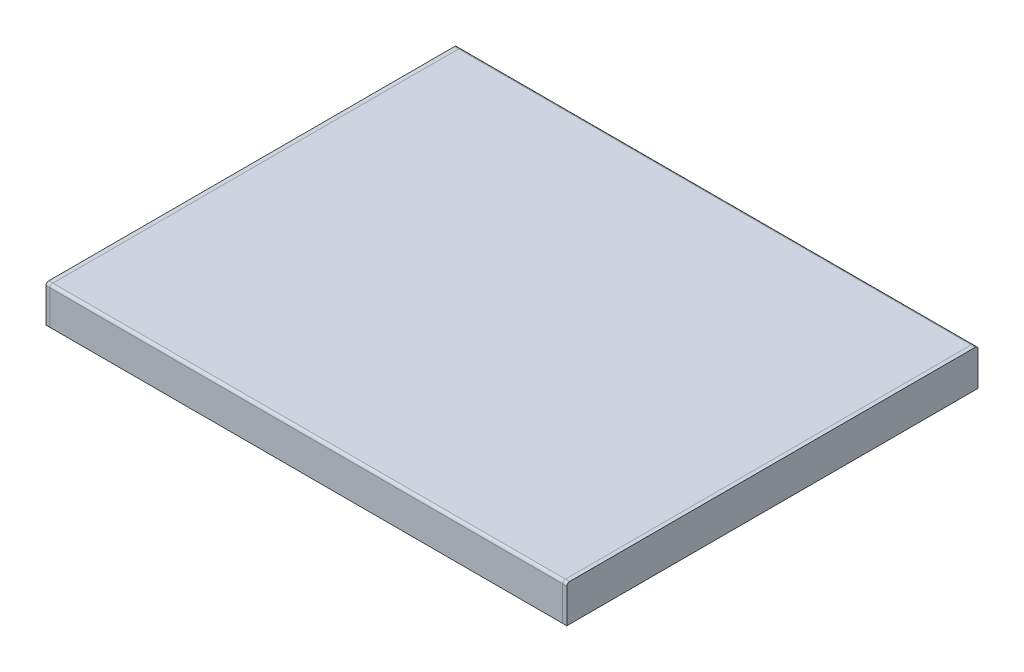
from build123d import *

# Parameters (mm, degrees)
SKETCH1_W           = 374
SKETCH1_H           = 300
BODY_DEPTH          = 27
SKETCH2_R           = 20
FEET_DEPTH          = 7
FEET_2_DEPTH        = 7
FEET_3_DEPTH        = 7
FEET_4_DEPTH        = 7
EDGES_2_R           = 2
END_CAP_A_DEPTH     = 3
END_START           = -374
END_CAP_B_DEPTH     = 3
SKETCH5_R           = 16
BOSS_EXTRUDE8_DEPTH = 5


with BuildPart() as part:
    # Sketch1 → Body (new body)
    with BuildSketch(Plane(origin=(0, 0, 0), x_dir=(1, 0, 0), z_dir=(0, 1, 0))):
        Rectangle(SKETCH1_W, SKETCH1_H)
    extrude(amount=BODY_DEPTH)

    # Edges 2
    edges_2_edges = [part.edges().sort_by_distance(p)[0] for p in [
        (0, 27, 150),
        (0, 27, -150),
    ]]
    fillet(edges_2_edges, radius=EDGES_2_R)


with BuildPart() as body_2:
    # Sketch2 → Feet (new body)
    with BuildSketch(Plane.XZ):
        with Locations(Location((-152, 115, 0), (0, 0, 270))):
            Circle(SKETCH2_R)
    extrude(amount=FEET_DEPTH)



with BuildPart() as body_3:
    # Sketch2 → Feet 2 (new body)
    with BuildSketch(Plane.XZ):
        with Locations(Location((152, 115, 0), (0, 0, 270))):
            Circle(SKETCH2_R)
    extrude(amount=FEET_2_DEPTH)


with BuildPart() as body_4:
    # Sketch2 → Feet 3 (new body)
    with BuildSketch(Plane.XZ):
        with Locations(Location((-152, -115, 0), (0, 0, 270))):
            Circle(SKETCH2_R)
    extrude(amount=FEET_3_DEPTH)


with BuildPart() as body_5:
    # Sketch2 → Feet 4 (new body)
    with BuildSketch(Plane.XZ):
        with Locations(Location((152, -115, 0), (0, 0, 270))):
            Circle(SKETCH2_R)
    extrude(amount=FEET_4_DEPTH)


with BuildPart() as body_6:
    # Sketch4 → End Cap A (new body)
    with BuildSketch(Plane.ZY.offset(187)):
        with BuildLine():
            Line((148, 27), (-148, 27))
            ThreePointArc((-148, 27), (-149.414213562, 26.414213562), (-150, 25))
            Line((-150, 25), (-150, 0))
            Line((-150, 0), (150, 0))
            Line((150, 0), (150, 25))
            ThreePointArc((150, 25), (149.414213562, 26.414213562), (148, 27))
        make_face()
    extrude(amount=END_CAP_A_DEPTH)


with BuildPart() as body_7:
    # Sketch4<2> → End Cap B (new body)
    with BuildSketch(Plane.ZY.offset(187).offset(END_START)):
        with BuildLine():
            Line((148, 27), (-148, 27))
            ThreePointArc((-148, 27), (-149.414213562, 26.414213562), (-150, 25))
            Line((-150, 25), (-150, 0))
            Line((-150, 0), (150, 0))
            Line((150, 0), (150, 25))
            ThreePointArc((150, 25), (149.414213562, 26.414213562), (148, 27))
        make_face()
    extrude(amount=-END_CAP_B_DEPTH)


with BuildPart() as body_2_1:
    add(body_2.part)

    add(body_3.part)  # Boss-Extrude8 merges body 3

    add(body_4.part)  # Boss-Extrude8 merges body 4

    add(body_5.part)  # Boss-Extrude8 merges body 5
    # Sketch5 → Boss-Extrude8 (add)
    with BuildSketch(Plane.XZ.offset(7)):
        with Locations(Location((-152, 115, 0), (0, 0, 270))):
            Circle(SKETCH5_R)
        with Locations(Location((152, 115, 0), (0, 0, 270))):
            Circle(SKETCH5_R)
        with Locations(Location((152, -115, 0), (0, 0, 270))):
            Circle(SKETCH5_R)
        with Locations(Location((-152, -115, 0), (0, 0, 270))):
            Circle(SKETCH5_R)
    extrude(amount=BOSS_EXTRUDE8_DEPTH)


solid = Compound([part.part, body_6.part, body_7.part, body_2_1.part])
